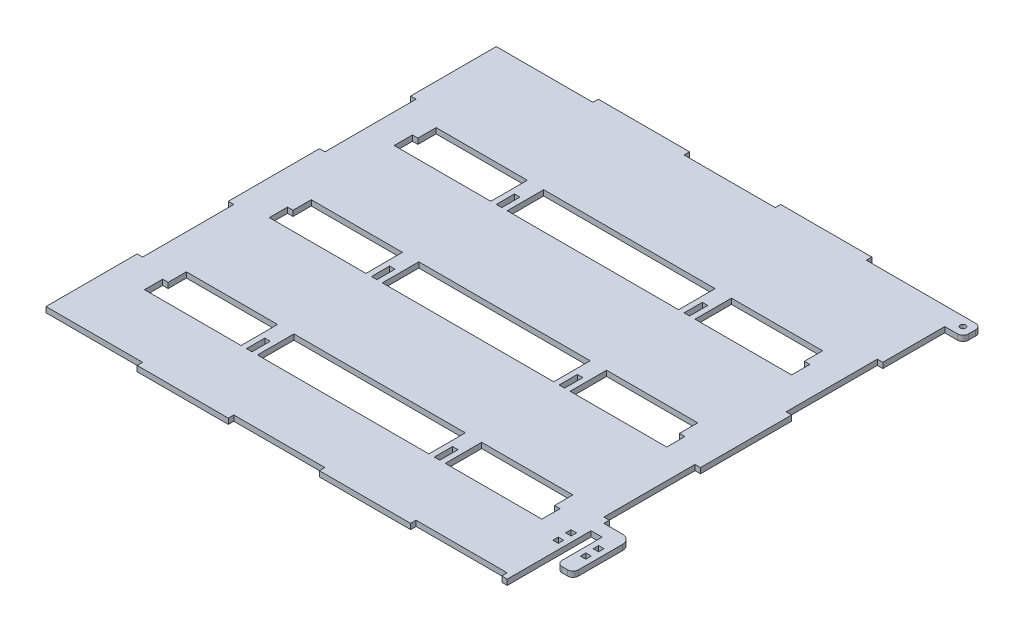
from build123d import *

# Parameters (mm, degrees)
SKETCH1_R           = 1.5
SKETCH1_W           = 3
SKETCH1_H           = 3
SKETCH1_W_2         = 94
SKETCH1_H_2         = 20
SKETCH1_H_3         = 10
BOSS_EXTRUDE1_DEPTH = 3


with BuildPart() as part:
    # Sketch1 → Boss-Extrude1 (new body)
    with BuildSketch(Plane(origin=(0, 0, 0), x_dir=(1, 0, 0), z_dir=(0, 1, 0))):
        with BuildLine():
            Line((256, 103), (256, 153))
            Line((256, 153), (253, 153))
            Line((253, 153), (253, 203))
            Line((253, 203), (256, 203))
            Line((256, 203), (256, 237))
            Line((256, 237), (263, 237))
            ThreePointArc((263, 237), (265.121320344, 237.878679656), (266, 240))
            Line((266, 240), (266, 244))
            ThreePointArc((266, 244), (265.121320344, 246.121320344), (263, 247))
            Line((263, 247), (253, 247))
            Line((253, 247), (203, 247))
            Line((203, 247), (203, 250))
            Line((203, 250), (153, 250))
            Line((153, 250), (153, 247))
            Line((153, 247), (103, 247))
            Line((103, 247), (103, 250))
            Line((103, 250), (53, 250))
            Line((53, 250), (53, 247))
            Line((53, 247), (0, 247))
            Line((0, 247), (0, 200))
            Line((0, 200), (3, 200))
            Line((3, 200), (3, 150))
            Line((3, 150), (0, 150))
            Line((0, 150), (0, 100))
            Line((0, 100), (3, 100))
            Line((3, 100), (3, 50))
            Line((3, 50), (0, 50))
            Line((0, 50), (0, 0))
            Line((0, 0), (53, 0))
            Line((53, 0), (53, -3))
            Line((53, -3), (103, -3))
            Line((103, -3), (103, 0))
            Line((103, 0), (153, 0))
            Line((153, 0), (153, -3))
            Line((153, -3), (203, -3))
            Line((203, -3), (203, 0))
            Line((203, 0), (253, 0))
            Line((253, 0), (253, -3))
            Line((253, -3), (256, -3))
            Line((256, -3), (256, 0))
            Line((256, 0), (256, 43))
            Line((256, 43), (262.1, 43))
            Line((262.1, 43), (262.1, 21))
            ThreePointArc((262.1, 21), (262.978679656, 18.878679656), (265.1, 18))
            Line((265.1, 18), (268.1, 18))
            ThreePointArc((268.1, 18), (270.221320344, 18.878679656), (271.1, 21))
            Line((271.1, 21), (271.1, 43))
            Line((271.1, 43), (271.1, 45))
            ThreePointArc((271.1, 45), (269.635533906, 48.535533906), (266.1, 50))
            Line((266.1, 50), (256, 50))
            Line((256, 50), (256, 53))
            Line((256, 53), (253, 53))
            Line((253, 53), (253, 103))
            Line((253, 103), (256, 103))
        make_face()
        with Locations(Location((261, 242, 0), (0, 0, 270))):
            Circle(SKETCH1_R, mode=Mode.SUBTRACT)
        with Locations((266.6, 29.5)):
            Rectangle(SKETCH1_W, SKETCH1_H, mode=Mode.SUBTRACT)
        with Locations((128, 45)):
            Rectangle(SKETCH1_W_2, SKETCH1_H_2, mode=Mode.SUBTRACT)
        with Locations((266.6, 36.5)):
            Rectangle(SKETCH1_W, SKETCH1_H, mode=Mode.SUBTRACT)
        with Locations((251.5, 29.5)):
            Rectangle(SKETCH1_W, SKETCH1_H, mode=Mode.SUBTRACT)
        with Locations((251.5, 36.5)):
            Rectangle(SKETCH1_W, SKETCH1_H, mode=Mode.SUBTRACT)
        Polygon((184, 35), (234, 35), (237, 35), (237, 45), (234, 45), (234, 55), (184, 55), align=None, mode=Mode.SUBTRACT)
        with Locations((76.5, 40)):
            Rectangle(SKETCH1_W, SKETCH1_H_3, mode=Mode.SUBTRACT)
        Polygon((184, 103.5), (234, 103.5), (237, 103.5), (237, 113.5), (234, 113.5), (234, 123.5), (184, 123.5), align=None, mode=Mode.SUBTRACT)
        with Locations((179.5, 40)):
            Rectangle(SKETCH1_W, SKETCH1_H_3, mode=Mode.SUBTRACT)
        with Locations((128, 113.5)):
            Rectangle(SKETCH1_W_2, SKETCH1_H_2, mode=Mode.SUBTRACT)
        with Locations((76.5, 108.5)):
            Rectangle(SKETCH1_W, SKETCH1_H_3, mode=Mode.SUBTRACT)
        with Locations((128, 182)):
            Rectangle(SKETCH1_W_2, SKETCH1_H_2, mode=Mode.SUBTRACT)
        with Locations((179.5, 108.5)):
            Rectangle(SKETCH1_W, SKETCH1_H_3, mode=Mode.SUBTRACT)
        Polygon((184, 172), (234, 172), (237, 172), (237, 182), (234, 182), (234, 192), (184, 192), align=None, mode=Mode.SUBTRACT)
        with Locations((76.5, 177)):
            Rectangle(SKETCH1_W, SKETCH1_H_3, mode=Mode.SUBTRACT)
        with Locations((179.5, 177)):
            Rectangle(SKETCH1_W, SKETCH1_H_3, mode=Mode.SUBTRACT)
        Polygon((22, 35), (72, 35), (72, 55), (22, 55), (22, 45), (19, 45), (19, 35), align=None, mode=Mode.SUBTRACT)
        Polygon((22, 103.5), (72, 103.5), (72, 123.5), (22, 123.5), (22, 113.5), (19, 113.5), (19, 103.5), align=None, mode=Mode.SUBTRACT)
        Polygon((22, 172), (72, 172), (72, 192), (22, 192), (22, 182), (19, 182), (19, 172), align=None, mode=Mode.SUBTRACT)
    extrude(amount=BOSS_EXTRUDE1_DEPTH)


solid = part.part
